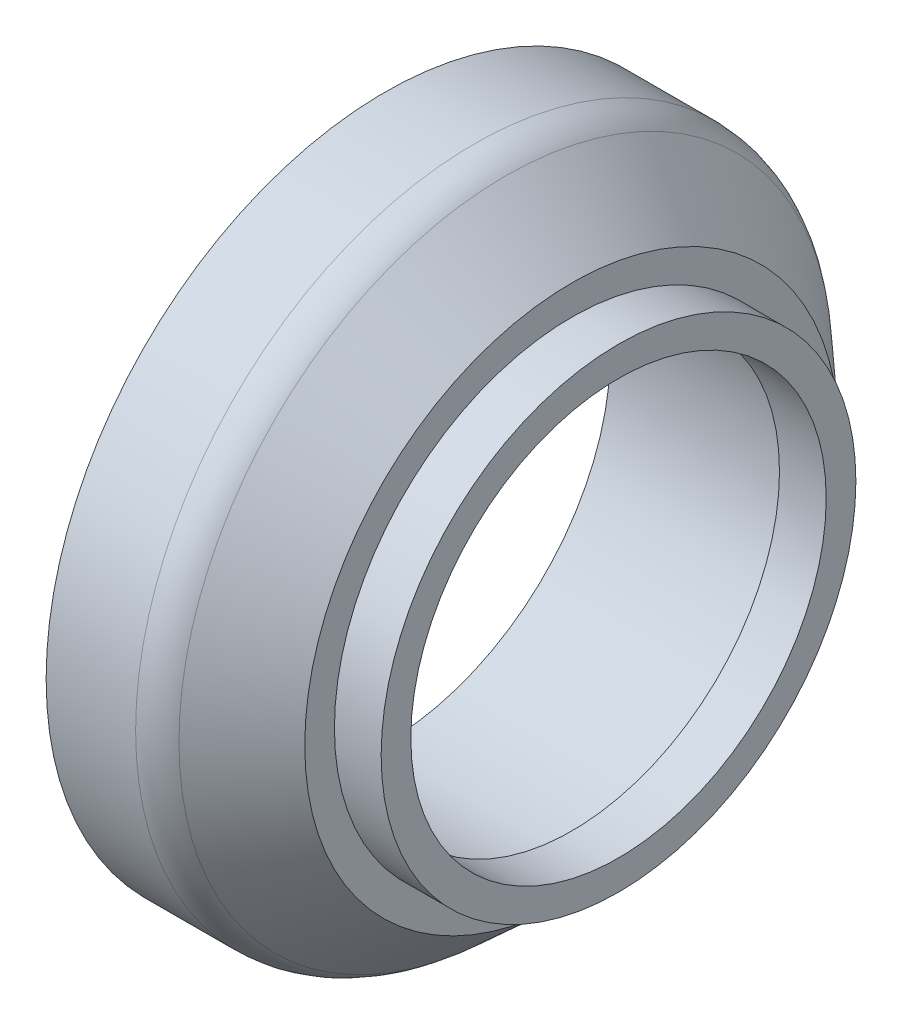
from build123d import *

# Parameters (mm, degrees)
FILLET1_R                    = 10
SKETCH2_R                    = 50.8
SKETCH2_R_2                  = 44.45
BOSS_EXTRUDE1_DEPTH          = 10
SKETCH3_R                    = 5.35
CUT_EXTRUDE1_DEPTH           = 19.4
CHAMFER1_SIZE                = 1
CIRPATTERN1_COUNT            = 12
CHAMFER1_OF_CIRPATTERN1_SIZE = 1


with BuildPart() as part:
    # Sketch1 → Revolve1 (revolve)
    with BuildSketch(Plane.XY, mode=Mode.PRIVATE) as revolve1_sk:
        Polygon((0, 48.25), (40, 48.25), (40, 57.15), (23, 72.5), (0, 72.5), align=None)
    revolve(revolve1_sk.sketch.rotate(Axis((0, 0, 0), (1, 0, 0)), 90), axis=Axis((0, 0, 0), (1, 0, 0)))

    # Fillet1
    fillet1_edges = [part.edges().sort_by_distance(p)[0] for p in [
        (23, 0, -72.5),
    ]]
    fillet(fillet1_edges, radius=FILLET1_R)

    # Sketch2 → Boss-Extrude1 (add)
    with BuildSketch(Plane(origin=(40, 0, 0), x_dir=(0, 0, -1), z_dir=(1, 0, 0))):
        with Locations(Location((0, 0, 0), (0, 0, 180))):
            Circle(SKETCH2_R)
        Circle(SKETCH2_R_2, mode=Mode.SUBTRACT)
    extrude(amount=BOSS_EXTRUDE1_DEPTH)

    # Sketch3 → Cut-Extrude1 (cut)
    with BuildSketch(Plane.ZY):
        with Locations((0, 63.817098441)):
            Circle(SKETCH3_R)
    cut_extrude1 = extrude(amount=-CUT_EXTRUDE1_DEPTH, mode=Mode.SUBTRACT)

    # Chamfer1
    chamfer1_edges = [part.edges().sort_by_distance(p)[0] for p in [
        (0, 63.817098441, -5.35),
    ]]
    chamfer(chamfer1_edges, length=CHAMFER1_SIZE)

    # CirPattern1: Cut-Extrude1 ×12 about axis
    cirpattern1_axis = Axis((0, 0, 0), (1, 0, 0))
    for i in range(1, CIRPATTERN1_COUNT):
        add(cut_extrude1.rotate(cirpattern1_axis, i * 360 / CIRPATTERN1_COUNT), mode=Mode.SUBTRACT)

    # Chamfer1 of CirPattern1
    chamfer1_of_cirpattern1_edges = [part.edges().sort_by_distance(p)[0] for p in [
        (0, 57.942228446, 27.27531331),
        (0, 36.541785131, 52.592228446),
        (0, 5.35, 63.817098441),
        (0, -27.27531331, 57.942228446),
        (0, -52.592228446, 36.541785131),
        (0, -63.817098441, 5.35),
        (0, -57.942228446, -27.27531331),
        (0, -36.541785131, -52.592228446),
        (0, -5.35, -63.817098441),
        (0, 27.27531331, -57.942228446),
        (0, 52.592228446, -36.541785131),
    ]]
    chamfer(chamfer1_of_cirpattern1_edges, length=CHAMFER1_OF_CIRPATTERN1_SIZE)


solid = part.part
